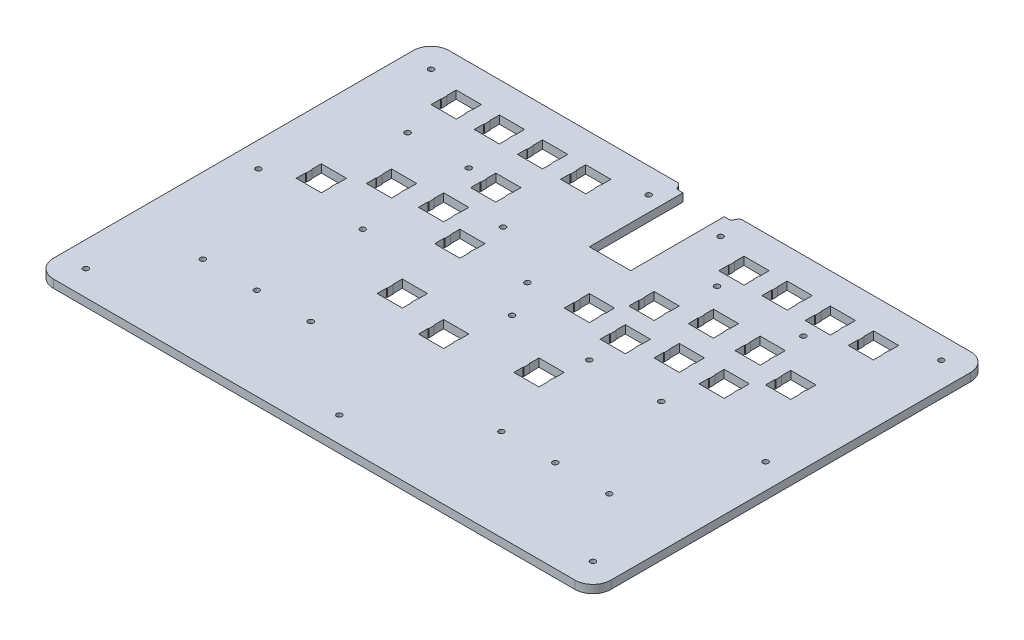
from build123d import *

# Parameters (mm, degrees)
SKETCH_1_R      = 1.5
EXTRUDE_1_DEPTH = 4.5


with BuildPart() as part:
    # 草图1 → 凸台-拉伸1 (new body)
    with BuildSketch(Plane(origin=(0, 0, 0), x_dir=(1, 0, 0), z_dir=(0, 1, 0))):
        with BuildLine():
            Line((10, 0), (136.884360712, 0))
            ThreePointArc((136.884360712, 0), (137.900113715, -0.277140216), (138.634360712, -1.031754163))
            Line((138.634360712, -1.031754163), (139.429147615, -2.468245837))
            ThreePointArc((139.429147615, -2.468245837), (140.163394612, -3.222859784), (141.179147615, -3.5))
            Line((141.179147615, -3.5), (143.5, -3.5))
            Line((143.5, -3.5), (143.5, -55.5))
            Line((143.5, -55.5), (166.5, -55.5))
            Line((166.5, -55.5), (166.5, -3.5))
            Line((166.5, -3.5), (168.820852385, -3.5))
            ThreePointArc((168.820852385, -3.5), (169.836605388, -3.222859784), (170.570852385, -2.468245837))
            Line((170.570852385, -2.468245837), (171.365639288, -1.031754163))
            ThreePointArc((171.365639288, -1.031754163), (172.099886285, -0.277140216), (173.115639288, 0))
            Line((173.115639288, 0), (300, 0))
            ThreePointArc((300, 0), (307.071067812, -2.928932188), (310, -10))
            Line((310, -10), (310, -210))
            ThreePointArc((310, -210), (307.071067812, -217.071067812), (300, -220))
            Line((300, -220), (10, -220))
            ThreePointArc((10, -220), (2.928932188, -217.071067812), (0, -210))
            Line((0, -210), (0, -10))
            ThreePointArc((0, -10), (2.928932188, -2.928932188), (10, 0))
        make_face()
        with Locations(Location((14, -14, 0), (0, 0, 270))):
            Circle(SKETCH_1_R, mode=Mode.SUBTRACT)
        with Locations(Location((14, -206, 0), (0, 0, 270))):
            Circle(SKETCH_1_R, mode=Mode.SUBTRACT)
        with Locations(Location((296, -206, 0), (0, 0, 270))):
            Circle(SKETCH_1_R, mode=Mode.SUBTRACT)
        with Locations(Location((296, -12.28568254, 0), (0, 0, 270))):
            Circle(SKETCH_1_R, mode=Mode.SUBTRACT)
        with Locations(Location((155, -206, 0), (0, 0, 270))):
            Circle(SKETCH_1_R, mode=Mode.SUBTRACT)
        with Locations(Location((175, -14, 0), (0, 0, 270))):
            Circle(SKETCH_1_R, mode=Mode.SUBTRACT)
        with Locations(Location((135, -14, 0), (0, 0, 270))):
            Circle(SKETCH_1_R, mode=Mode.SUBTRACT)
        with Locations(Location((296, -110, 0), (0, 0, 270))):
            Circle(SKETCH_1_R, mode=Mode.SUBTRACT)
        with Locations(Location((14, -110, 0), (0, 0, 270))):
            Circle(SKETCH_1_R, mode=Mode.SUBTRACT)
        with Locations(Location((155, -110, 0), (0, 0, 270))):
            Circle(SKETCH_1_R, mode=Mode.SUBTRACT)
        with Locations(Location((72, -110, 0), (0, 0, 270))):
            Circle(SKETCH_1_R, mode=Mode.SUBTRACT)
        with Locations(Location((72, -168.903225806, 0), (0, 0, 270))):
            Circle(SKETCH_1_R, mode=Mode.SUBTRACT)
        with Locations(Location((72, -51.096774194, 0), (0, 0, 270))):
            Circle(SKETCH_1_R, mode=Mode.SUBTRACT)
        with Locations(Location((42, -168.903225806, 0), (0, 0, 270))):
            Circle(SKETCH_1_R, mode=Mode.SUBTRACT)
        with Locations(Location((102, -168.903225806, 0), (0, 0, 270))):
            Circle(SKETCH_1_R, mode=Mode.SUBTRACT)
        with Locations(Location((238, -110, 0), (0, 0, 270))):
            Circle(SKETCH_1_R, mode=Mode.SUBTRACT)
        with Locations(Location((238, -168.903225806, 0), (0, 0, 270))):
            Circle(SKETCH_1_R, mode=Mode.SUBTRACT)
        with Locations(Location((268, -168.903225806, 0), (0, 0, 270))):
            Circle(SKETCH_1_R, mode=Mode.SUBTRACT)
        with Locations(Location((208, -168.903225806, 0), (0, 0, 270))):
            Circle(SKETCH_1_R, mode=Mode.SUBTRACT)
        with Locations(Location((246, -39, 0), (0, 0, 270))):
            Circle(SKETCH_1_R, mode=Mode.SUBTRACT)
        with Locations(Location((198, -39, 0), (0, 0, 270))):
            Circle(SKETCH_1_R, mode=Mode.SUBTRACT)
        with Locations(Location((110, -70, 0), (0, 0, 270))):
            Circle(SKETCH_1_R, mode=Mode.SUBTRACT)
        with Locations(Location((38, -51.096774194, 0), (0, 0, 270))):
            Circle(SKETCH_1_R, mode=Mode.SUBTRACT)
        with Locations(Location((198, -110, 0), (0, 0, 270))):
            Circle(SKETCH_1_R, mode=Mode.SUBTRACT)
        with Locations(Location((143.5, -90, 0), (0, 0, 270))):
            Circle(SKETCH_1_R, mode=Mode.SUBTRACT)
        Polygon((183.25, -128.5), (183.25, -131.5), (183, -131.75), (183, -137), (197, -137), (197, -131.75), (196.75, -131.5), (196.75, -128.5), (197, -128.25), (197, -123), (183, -123), (183, -128.25), align=None, mode=Mode.SUBTRACT)
        Polygon((31.25, -22.5), (31.25, -25.5), (31, -25.75), (31, -31), (45, -31), (45, -25.75), (44.75, -25.5), (44.75, -22.5), (45, -22.25), (45, -17), (31, -17), (31, -22.25), align=None, mode=Mode.SUBTRACT)
        Polygon((55.25, -22.5), (55.25, -25.5), (55, -25.75), (55, -31), (69, -31), (69, -25.75), (68.75, -25.5), (68.75, -22.5), (69, -22.25), (69, -17), (55, -17), (55, -22.25), align=None, mode=Mode.SUBTRACT)
        Polygon((79.25, -22.5), (79.25, -25.5), (79, -25.75), (79, -31), (93, -31), (93, -25.75), (92.75, -25.5), (92.75, -22.5), (93, -22.25), (93, -17), (79, -17), (79, -22.25), align=None, mode=Mode.SUBTRACT)
        Polygon((103.25, -22.5), (103.25, -25.5), (103, -25.75), (103, -31), (117, -31), (117, -25.75), (116.75, -25.5), (116.75, -22.5), (117, -22.25), (117, -17), (103, -17), (103, -22.25), align=None, mode=Mode.SUBTRACT)
        Polygon((191.25, -22.5), (191.25, -25.5), (191, -25.75), (191, -31), (205, -31), (205, -25.75), (204.75, -25.5), (204.75, -22.5), (205, -22.25), (205, -17), (191, -17), (191, -22.25), align=None, mode=Mode.SUBTRACT)
        Polygon((215.25, -22.5), (215.25, -25.5), (215, -25.75), (215, -31), (229, -31), (229, -25.75), (228.75, -25.5), (228.75, -22.5), (229, -22.25), (229, -17), (215, -17), (215, -22.25), align=None, mode=Mode.SUBTRACT)
        Polygon((239.25, -22.5), (239.25, -25.5), (239, -25.75), (239, -31), (253, -31), (253, -25.75), (252.75, -25.5), (252.75, -22.5), (253, -22.25), (253, -17), (239, -17), (239, -22.25), align=None, mode=Mode.SUBTRACT)
        Polygon((263.25, -22.5), (263.25, -25.5), (263, -25.75), (263, -31), (277, -31), (277, -25.75), (276.75, -25.5), (276.75, -22.5), (277, -22.25), (277, -17), (263, -17), (263, -22.25), align=None, mode=Mode.SUBTRACT)
        Polygon((259.25, -64.5), (259.25, -67.5), (259, -67.75), (259, -73), (273, -73), (273, -67.75), (272.75, -67.5), (272.75, -64.5), (273, -64.25), (273, -59), (259, -59), (259, -64.25), align=None, mode=Mode.SUBTRACT)
        Polygon((240.25, -82.5), (240.25, -85.5), (240, -85.75), (240, -91), (254, -91), (254, -85.75), (253.75, -85.5), (253.75, -82.5), (254, -82.25), (254, -77), (240, -77), (240, -82.25), align=None, mode=Mode.SUBTRACT)
        Polygon((234.25, -56.5), (234.25, -59.5), (234, -59.75), (234, -65), (248, -65), (248, -59.75), (247.75, -59.5), (247.75, -56.5), (248, -56.25), (248, -51), (234, -51), (234, -56.25), align=None, mode=Mode.SUBTRACT)
        Polygon((215.25, -82.5), (215.25, -85.5), (215, -85.75), (215, -91), (229, -91), (229, -85.75), (228.75, -85.5), (228.75, -82.5), (229, -82.25), (229, -77), (215, -77), (215, -82.25), align=None, mode=Mode.SUBTRACT)
        Polygon((29.25, -95.5), (29.25, -98.5), (29, -98.75), (29, -104), (43, -104), (43, -98.75), (42.75, -98.5), (42.75, -95.5), (43, -95.25), (43, -90), (29, -90), (29, -95.25), align=None, mode=Mode.SUBTRACT)
        Polygon((51.25, -78.5), (51.25, -81.5), (51, -81.75), (51, -87), (65, -87), (65, -81.75), (64.75, -81.5), (64.75, -78.5), (65, -78.25), (65, -73), (51, -73), (51, -78.25), align=None, mode=Mode.SUBTRACT)
        Polygon((77.25, -75.5), (77.25, -78.5), (77, -78.75), (77, -84), (91, -84), (91, -78.75), (90.75, -78.5), (90.75, -75.5), (91, -75.25), (91, -70), (77, -70), (77, -75.25), align=None, mode=Mode.SUBTRACT)
        Polygon((82.25, -51.5), (82.25, -54.5), (82, -54.75), (82, -60), (96, -60), (96, -54.75), (95.75, -54.5), (95.75, -51.5), (96, -51.25), (96, -46), (82, -46), (82, -51.25), align=None, mode=Mode.SUBTRACT)
        Polygon((99.25, -88.5), (99.25, -91.5), (99, -91.75), (99, -97), (113, -97), (113, -91.75), (112.75, -91.5), (112.75, -88.5), (113, -88.25), (113, -83), (99, -83), (99, -88.25), align=None, mode=Mode.SUBTRACT)
        Polygon((208.25, -56.5), (208.25, -59.5), (208, -59.75), (208, -65), (222, -65), (222, -59.75), (221.75, -59.5), (221.75, -56.5), (222, -56.25), (222, -51), (208, -51), (208, -56.25), align=None, mode=Mode.SUBTRACT)
        Polygon((183.25, -64.5), (183.25, -67.5), (183, -67.75), (183, -73), (197, -73), (197, -67.75), (196.75, -67.5), (196.75, -64.5), (197, -64.25), (197, -59), (183, -59), (183, -64.25), align=None, mode=Mode.SUBTRACT)
        Polygon((191.25, -88.5), (191.25, -91.5), (191, -91.75), (191, -97), (205, -97), (205, -91.75), (204.75, -91.5), (204.75, -88.5), (205, -88.25), (205, -83), (191, -83), (191, -88.25), align=None, mode=Mode.SUBTRACT)
        Polygon((166.25, -83.5), (166.25, -86.5), (166, -86.75), (166, -92), (180, -92), (180, -86.75), (179.75, -86.5), (179.75, -83.5), (180, -83.25), (180, -78), (166, -78), (166, -83.25), align=None, mode=Mode.SUBTRACT)
        Polygon((107.25, -128.5), (107.25, -131.5), (107, -131.75), (107, -137), (121, -137), (121, -131.75), (120.75, -131.5), (120.75, -128.5), (121, -128.25), (121, -123), (107, -123), (107, -128.25), align=None, mode=Mode.SUBTRACT)
        Polygon((138.25, -136.5), (138.25, -139.5), (138, -139.75), (138, -145), (152, -145), (152, -139.75), (151.75, -139.5), (151.75, -136.5), (152, -136.25), (152, -131), (138, -131), (138, -136.25), align=None, mode=Mode.SUBTRACT)
    extrude(amount=EXTRUDE_1_DEPTH)


solid = part.part
